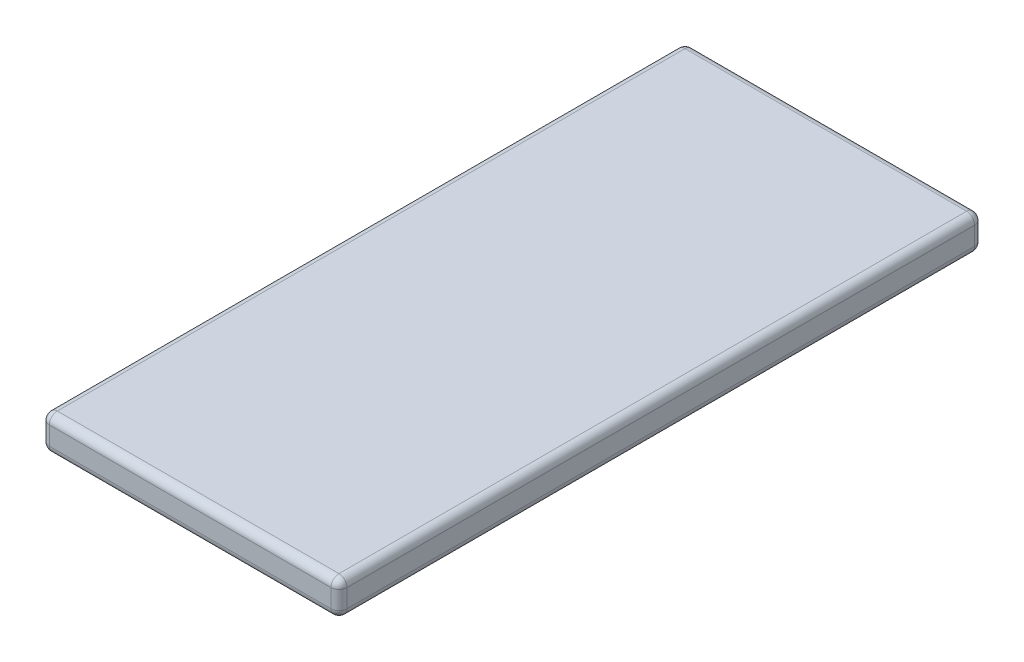
from build123d import *

# Parameters (mm, degrees)
SKETCH1_W           = 74
SKETCH1_H           = 160
BOSS_EXTRUDE1_DEPTH = 8.56
FILLET1_R           = 2


with BuildPart() as part:
    # Sketch1 → Boss-Extrude1 (new body)
    with BuildSketch(Plane(origin=(0, 0, 0), x_dir=(1, 0, 0), z_dir=(0, 1, 0))):
        Rectangle(SKETCH1_W, SKETCH1_H)
    extrude(amount=BOSS_EXTRUDE1_DEPTH)

    # Fillet1
    fillet1_edges = [part.edges().sort_by_distance(p)[0] for p in [
        (-37, 8.56, 0),
        (0, 8.56, 80),
        (37, 8.56, 0),
        (0, 0, 80),
        (-37, 0, 0),
        (0, 0, -80),
        (37, 0, 0),
        (37, 4.28, 80),
        (-37, 4.28, 80),
        (-37, 4.28, -80),
        (37, 4.28, -80),
        (0, 8.56, -80),
    ]]
    fillet(fillet1_edges, radius=FILLET1_R)


solid = part.part
